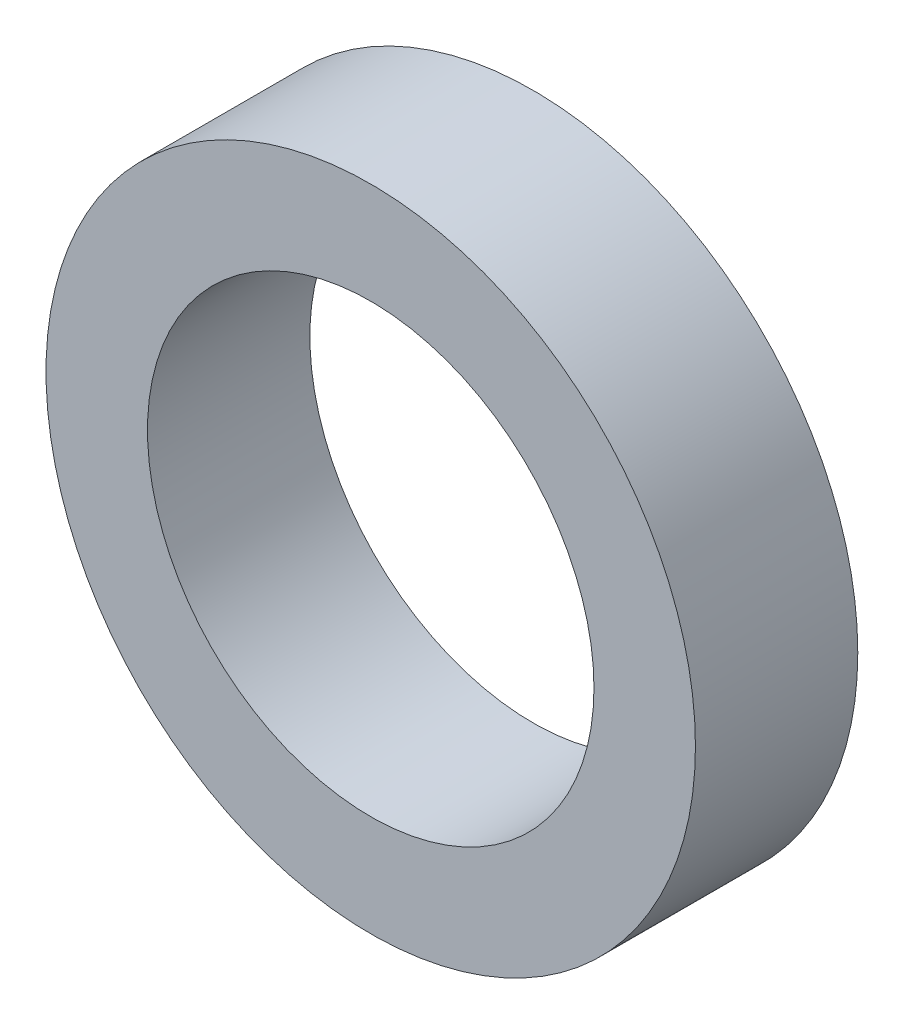
from build123d import *

# Parameters (mm, degrees)
SKETCH1_R           = 4
BOSS_EXTRUDE1_DEPTH = 2
SKETCH2_R           = 2.75
CUT_EXTRUDE1_DEPTH  = 7


with BuildPart() as part:
    # Sketch1 → Boss-Extrude1 (new body)
    with BuildSketch(Plane.XY):
        Circle(SKETCH1_R)
    extrude(amount=BOSS_EXTRUDE1_DEPTH)

    # Sketch2 → Cut-Extrude1 (cut, through all)
    with BuildSketch(Plane.XY.offset(2)):
        Circle(SKETCH2_R)
    extrude(amount=-CUT_EXTRUDE1_DEPTH, mode=Mode.SUBTRACT)


solid = part.part
